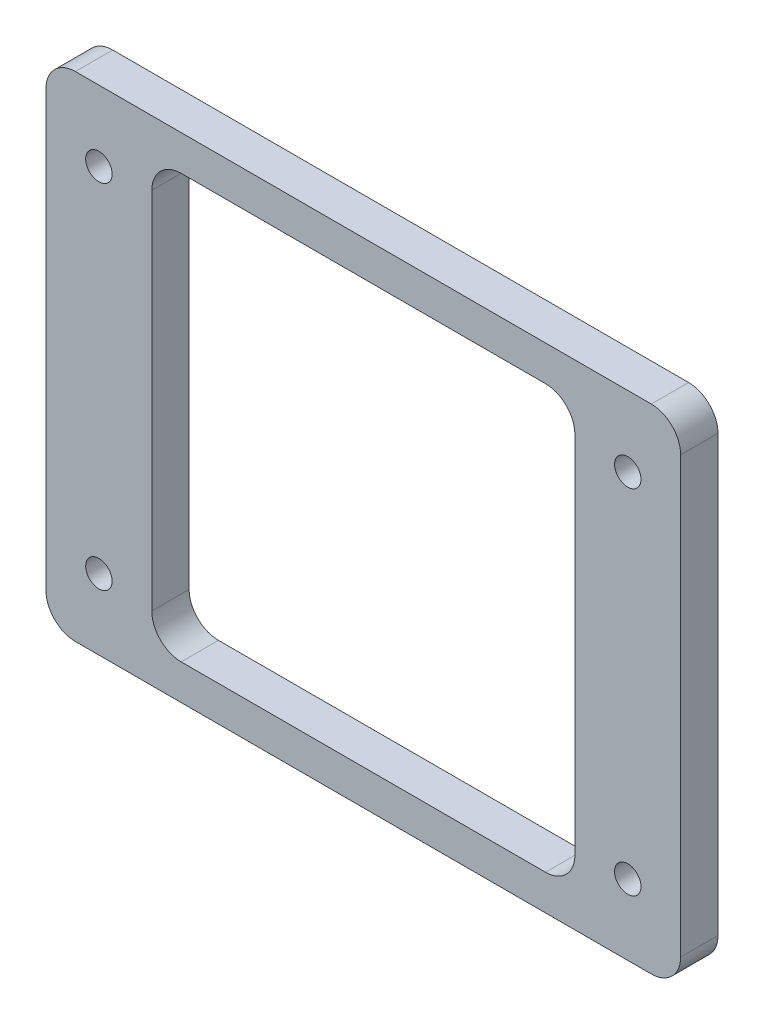
from build123d import *

# Parameters (mm, degrees)
SKETCH1_W           = 108
SKETCH1_H           = 84
SKETCH1_R           = 2.25
SKETCH1_W_2         = 72
SKETCH1_H_2         = 72
BOSS_EXTRUDE1_DEPTH = 6.35
FILLET1_R           = 5


with BuildPart() as part:
    # Sketch1 → Boss-Extrude1 (new body)
    with BuildSketch(Plane.XY):
        with Locations((0.107594743, 0)):
            Rectangle(SKETCH1_W, SKETCH1_H)
        with Locations((-44.892405257, 30)):
            Circle(SKETCH1_R, mode=Mode.SUBTRACT)
        with Locations((45.107594743, 30)):
            Circle(SKETCH1_R, mode=Mode.SUBTRACT)
        with Locations((45.107594743, -30)):
            Circle(SKETCH1_R, mode=Mode.SUBTRACT)
        with Locations((-44.892405257, -30)):
            Circle(SKETCH1_R, mode=Mode.SUBTRACT)
        with Locations((0.107594743, 0)):
            Rectangle(SKETCH1_W_2, SKETCH1_H_2, mode=Mode.SUBTRACT)
    extrude(amount=BOSS_EXTRUDE1_DEPTH)

    # Fillet1
    fillet1_edges = [part.edges().sort_by_distance(p)[0] for p in [
        (-35.892405257, 36, 3.175),
        (-35.892405257, -36, 3.175),
        (36.107594743, -36, 3.175),
        (36.107594743, 36, 3.175),
        (-53.892405257, 42, 3.175),
        (54.107594743, 42, 3.175),
        (54.107594743, -42, 3.175),
        (-53.892405257, -42, 3.175),
    ]]
    fillet(fillet1_edges, radius=FILLET1_R)


solid = part.part
